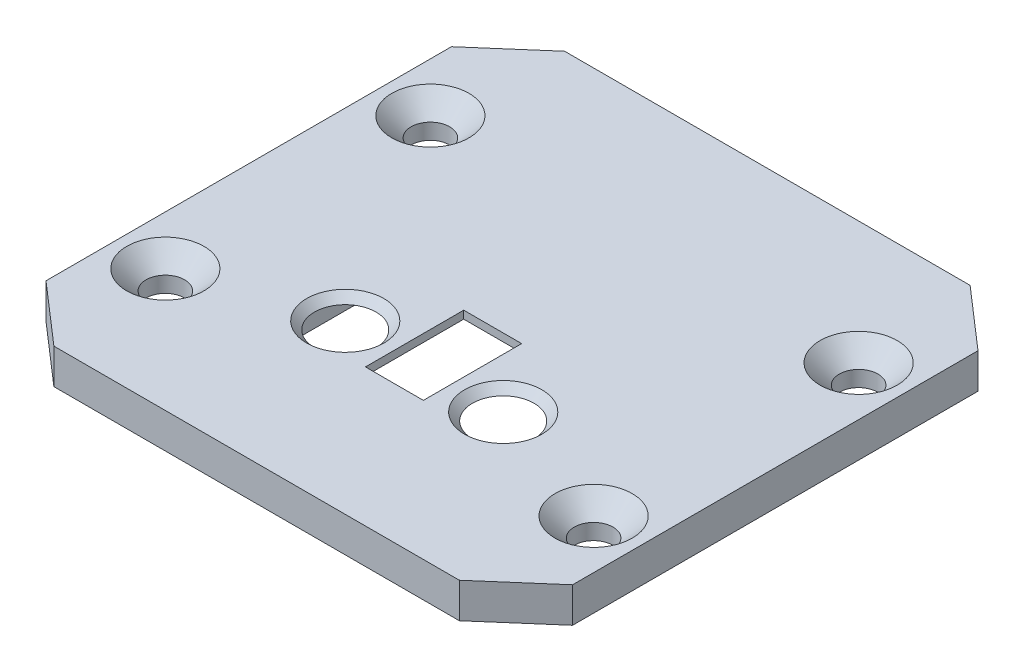
from build123d import *

# Parameters (mm, degrees)
BOSS_EXTRUDE1_DEPTH                             = 2
CSK_FOR_M2_FLAT_HEAD_MACHINE_SCREW1_D           = 2.2
CSK_FOR_M2_FLAT_HEAD_MACHINE_SCREW1_DEPTH       = 4
CSK_FOR_M2_FLAT_HEAD_MACHINE_SCREW1_CSINK_D     = 4.4
CSK_FOR_M2_FLAT_HEAD_MACHINE_SCREW1_CSINK_ANGLE = 90
CSK_FOR_M2_FLAT_HEAD_MACHINE_SCREW1_TIP         = 0.660946681
SKETCH9_W                                       = 14
SKETCH9_H                                       = 15
CUT_EXTRUDE4_DEPTH                              = 1.555
SKETCH10_R                                      = 0.5
CUT_EXTRUDE5_DEPTH                              = 1.555
CSK_FOR_M2_FLAT_HEAD_MACHINE_SCREW2_D           = 2.4
CSK_FOR_M2_FLAT_HEAD_MACHINE_SCREW2_DEPTH       = 4
CSK_FOR_M2_FLAT_HEAD_MACHINE_SCREW2_CSINK_D     = 4.4
CSK_FOR_M2_FLAT_HEAD_MACHINE_SCREW2_CSINK_ANGLE = 90
CSK_FOR_M2_FLAT_HEAD_MACHINE_SCREW2_TIP         = 0.721032743
SKETCH12_W                                      = 3.3
SKETCH12_H                                      = 5.6
CUT_EXTRUDE6_DEPTH                              = 31.296192101


with BuildPart() as part:
    # Sketch1 → Boss-Extrude1 (new body)
    with BuildSketch(Plane(origin=(0, 0, 0), x_dir=(1, 0, 0), z_dir=(0, 1, 0))):
        Polygon((-10.147286186, 19.79756588), (-10.147286186, -3.30243412), (-6.697286186, -6.30243412), (16.402713814, -6.30243412), (19.852713814, -3.30243412), (19.852713814, 19.79756588), (16.402713814, 22.79756588), (-6.697286186, 22.79756588), align=None)
    extrude(amount=BOSS_EXTRUDE1_DEPTH)

    # CSK for M2 Flat Head Machine Screw1
    with Locations(Plane(origin=(0, 2, 0), x_dir=(1, 0, 0), z_dir=(0, 1, 0))):
        with Locations((-7.347286186, 15.79756588), (17.052713814, 15.79756588), (17.052713814, 0.69756588), (-7.347286186, 0.69756588)):
            CounterSinkHole(CSK_FOR_M2_FLAT_HEAD_MACHINE_SCREW1_D / 2, CSK_FOR_M2_FLAT_HEAD_MACHINE_SCREW1_CSINK_D / 2, depth=CSK_FOR_M2_FLAT_HEAD_MACHINE_SCREW1_DEPTH, counter_sink_angle=CSK_FOR_M2_FLAT_HEAD_MACHINE_SCREW1_CSINK_ANGLE)
            with Locations((0, 0, -(CSK_FOR_M2_FLAT_HEAD_MACHINE_SCREW1_DEPTH + CSK_FOR_M2_FLAT_HEAD_MACHINE_SCREW1_TIP / 2))):  # 118° drill point
                Cone(0, CSK_FOR_M2_FLAT_HEAD_MACHINE_SCREW1_D / 2, CSK_FOR_M2_FLAT_HEAD_MACHINE_SCREW1_TIP, mode=Mode.SUBTRACT)

    # Sketch9 → Cut-Extrude4 (cut)
    with BuildSketch(Plane(origin=(0, 0, 0), x_dir=(1, 0, 0), z_dir=(0, 1, 0))):
        with Locations((4.852713814, 8.24756588)):
            Rectangle(SKETCH9_W, SKETCH9_H)
    extrude(amount=CUT_EXTRUDE4_DEPTH, mode=Mode.SUBTRACT)

    # Sketch10 → Cut-Extrude5 (cut)
    with BuildSketch(Plane.XZ.offset(-1.555)):
        with Locations((0.352713814, -3.24756588)):
            Circle(SKETCH10_R)
        with Locations((9.352713814, -3.24756588)):
            Circle(SKETCH10_R)
    extrude(amount=-CUT_EXTRUDE5_DEPTH, mode=Mode.SUBTRACT)

    # CSK for M2 Flat Head Machine Screw2
    with Locations(Plane(origin=(9.352713814, 2, -3.24756588), x_dir=(0, 0, 1), z_dir=(0, 1, 0))):
        with Locations((0, 0), (0, -9)):
            CounterSinkHole(CSK_FOR_M2_FLAT_HEAD_MACHINE_SCREW2_D / 2, CSK_FOR_M2_FLAT_HEAD_MACHINE_SCREW2_CSINK_D / 2, depth=CSK_FOR_M2_FLAT_HEAD_MACHINE_SCREW2_DEPTH, counter_sink_angle=CSK_FOR_M2_FLAT_HEAD_MACHINE_SCREW2_CSINK_ANGLE)
            with Locations((0, 0, -(CSK_FOR_M2_FLAT_HEAD_MACHINE_SCREW2_DEPTH + CSK_FOR_M2_FLAT_HEAD_MACHINE_SCREW2_TIP / 2))):  # 118° drill point
                Cone(0, CSK_FOR_M2_FLAT_HEAD_MACHINE_SCREW2_D / 2, CSK_FOR_M2_FLAT_HEAD_MACHINE_SCREW2_TIP, mode=Mode.SUBTRACT)

    # Sketch12 → Cut-Extrude6 (cut, through all)
    with BuildSketch(Plane(origin=(0, 2, 0), x_dir=(1, 0, 0), z_dir=(0, 1, 0))):
        with Locations((4.852713814, 4.34756588)):
            Rectangle(SKETCH12_W, SKETCH12_H)
    extrude(amount=-CUT_EXTRUDE6_DEPTH, mode=Mode.SUBTRACT)


solid = part.part
